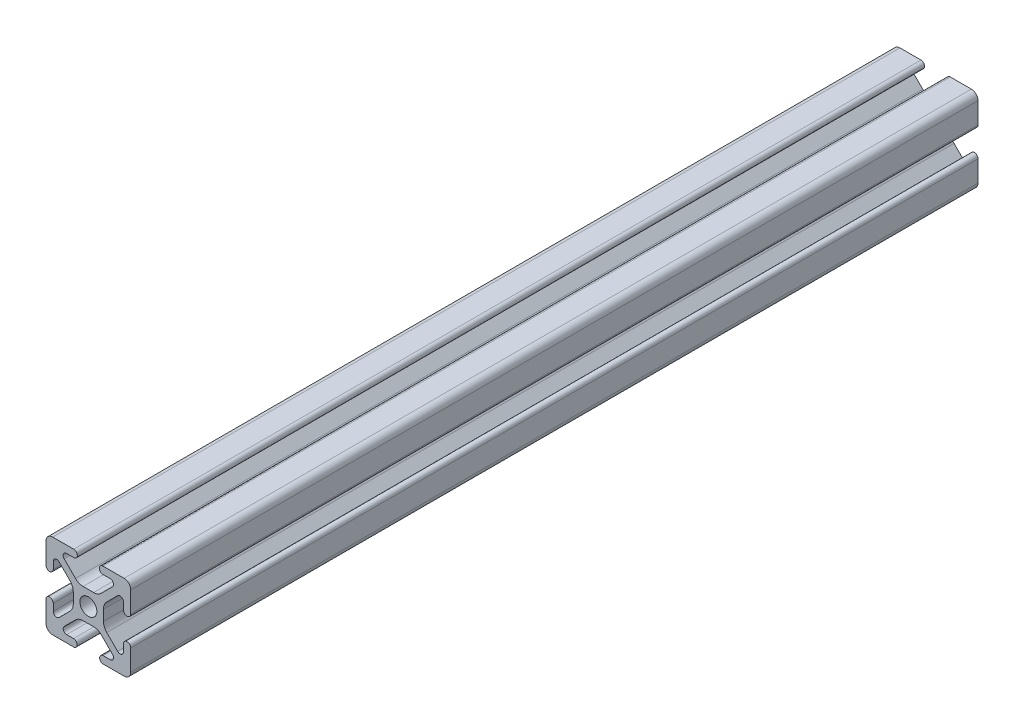
from build123d import *

# Parameters (mm, degrees)
SKETCH1_R          = 2.5
EXTRUDE1_DEPTH     = 250
SKETCH3_R          = 1.029384239
CUT_EXTRUDE1_DEPTH = 251.885874503


with BuildPart() as part:
    # Sketch1 → Extrude1 (new body)
    with BuildSketch(Plane.XY):
        with BuildLine():
            Line((-8.636346088, 7.111588351), (-5.432204773, 3.912143135))
            ThreePointArc((-5.432204773, 3.912143135), (-4.708985779, 2.831057106), (-4.455, 1.555406707))
            Line((-4.455, 1.555406707), (-4.455, -1.555406707))
            ThreePointArc((-4.455, -1.555406707), (-4.708985779, -2.831057106), (-5.432204773, -3.912143135))
            Line((-5.432204773, -3.912143135), (-8.636346088, -7.111588351))
            ThreePointArc((-8.636346088, -7.111588351), (-9.736852394, -7.329863489), (-10.36, -6.396886949))
            Line((-10.36, -6.396886949), (-10.36, -4.32))
            ThreePointArc((-10.36, -4.32), (-11.43, -3.25), (-12.5, -4.32))
            Line((-12.5, -4.32), (-12.5, -8.651801989))
            Line((-12.5, -8.651801989), (-12.5, -10.537068835))
            ThreePointArc((-12.5, -10.537068835), (-11.925070773, -11.925070773), (-10.537068835, -12.5))
            Line((-10.537068835, -12.5), (-8.441567612, -12.5))
            Line((-8.441567612, -12.5), (-4.387856959, -12.5))
            ThreePointArc((-4.387856959, -12.5), (-3.317856959, -11.43), (-4.387856959, -10.36))
            Line((-4.387856959, -10.36), (-6.42, -10.36))
            ThreePointArc((-6.42, -10.36), (-7.35325999, -9.736168088), (-7.133653912, -8.635298598))
            Line((-7.133653912, -8.635298598), (-3.795290766, -5.301828272))
            ThreePointArc((-3.795290766, -5.301828272), (-2.76743922, -4.61585726), (-1.555406707, -4.375))
            Line((-1.555406707, -4.375), (1.555406707, -4.375))
            ThreePointArc((1.555406707, -4.375), (2.76743922, -4.61585726), (3.795290766, -5.301828272))
            Line((3.795290766, -5.301828272), (7.133653912, -8.635298598))
            ThreePointArc((7.133653912, -8.635298598), (7.35325999, -9.736168088), (6.42, -10.36))
            Line((6.42, -10.36), (4.387856959, -10.36))
            ThreePointArc((4.387856959, -10.36), (3.317856959, -11.43), (4.387856959, -12.5))
            Line((4.387856959, -12.5), (8.441567612, -12.5))
            Line((8.441567612, -12.5), (10.537068835, -12.5))
            ThreePointArc((10.537068835, -12.5), (11.925070773, -11.925070773), (12.5, -10.537068835))
            Line((12.5, -10.537068835), (12.5, -8.651801989))
            Line((12.5, -8.651801989), (12.5, -4.32))
            ThreePointArc((12.5, -4.32), (11.43, -3.25), (10.36, -4.32))
            Line((10.36, -4.32), (10.36, -6.396886949))
            ThreePointArc((10.36, -6.396886949), (9.736852394, -7.329863489), (8.636346088, -7.111588351))
            Line((8.636346088, -7.111588351), (5.432204773, -3.912143135))
            ThreePointArc((5.432204773, -3.912143135), (4.708985779, -2.831057106), (4.455, -1.555406707))
            Line((4.455, -1.555406707), (4.455, 1.555406707))
            ThreePointArc((4.455, 1.555406707), (4.708985779, 2.831057106), (5.432204773, 3.912143135))
            Line((5.432204773, 3.912143135), (8.636346088, 7.111588351))
            ThreePointArc((8.636346088, 7.111588351), (9.736852394, 7.329863489), (10.36, 6.396886949))
            Line((10.36, 6.396886949), (10.36, 4.32))
            ThreePointArc((10.36, 4.32), (11.43, 3.25), (12.5, 4.32))
            Line((12.5, 4.32), (12.5, 7.99129648))
            Line((12.5, 7.99129648), (12.5, 10.537068835))
            ThreePointArc((12.5, 10.537068835), (11.925070773, 11.925070773), (10.537068835, 12.5))
            Line((10.537068835, 12.5), (4.32, 12.5))
            ThreePointArc((4.32, 12.5), (3.25, 11.43), (4.32, 10.36))
            Line((4.32, 10.36), (6.42, 10.36))
            ThreePointArc((6.42, 10.36), (7.35325999, 9.736168088), (7.133653912, 8.635298598))
            Line((7.133653912, 8.635298598), (3.795290766, 5.301828272))
            ThreePointArc((3.795290766, 5.301828272), (2.76743922, 4.61585726), (1.555406707, 4.375))
            Line((1.555406707, 4.375), (-1.555406707, 4.375))
            ThreePointArc((-1.555406707, 4.375), (-2.76743922, 4.61585726), (-3.795290766, 5.301828272))
            Line((-3.795290766, 5.301828272), (-7.133653912, 8.635298598))
            ThreePointArc((-7.133653912, 8.635298598), (-7.35325999, 9.736168088), (-6.42, 10.36))
            Line((-6.42, 10.36), (-4.32, 10.36))
            ThreePointArc((-4.32, 10.36), (-3.25, 11.43), (-4.32, 12.5))
            Line((-4.32, 12.5), (-10.537068835, 12.5))
            ThreePointArc((-10.537068835, 12.5), (-11.925070773, 11.925070773), (-12.5, 10.537068835))
            Line((-12.5, 10.537068835), (-12.5, 7.99129648))
            Line((-12.5, 7.99129648), (-12.5, 4.32))
            ThreePointArc((-12.5, 4.32), (-11.43, 3.25), (-10.36, 4.32))
            Line((-10.36, 4.32), (-10.36, 6.396886949))
            ThreePointArc((-10.36, 6.396886949), (-9.736852394, 7.329863489), (-8.636346088, 7.111588351))
        make_face()
        Circle(SKETCH1_R, mode=Mode.SUBTRACT)
    extrude(amount=-EXTRUDE1_DEPTH)

    # Sketch3 → Cut-Extrude1 (cut, through all)
    with BuildSketch(Plane(origin=(4.455, 0, 0), x_dir=(0, 0, -1), z_dir=(1, 0, 0))):
        with Locations((19.445862267, 0)):
            Circle(SKETCH3_R)
    extrude(amount=-CUT_EXTRUDE1_DEPTH, mode=Mode.SUBTRACT)


solid = part.part
